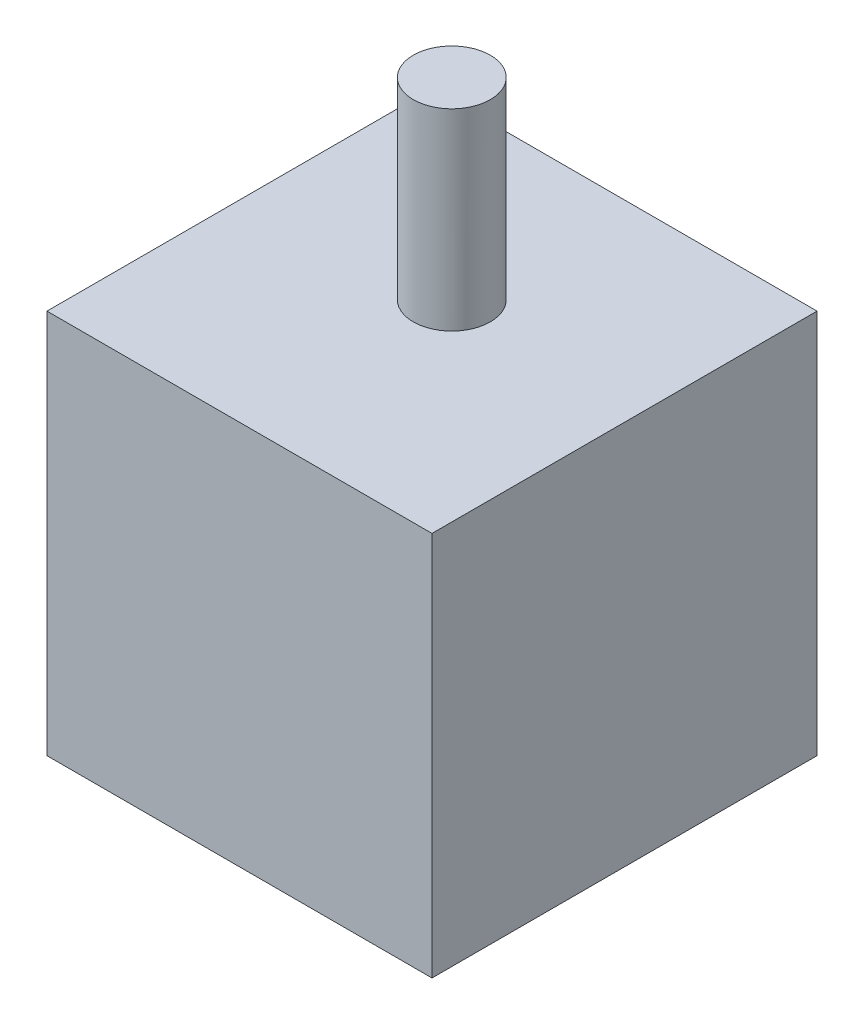
from build123d import *

# Parameters (mm, degrees)
SKETCH1_W           = 20
SKETCH1_H           = 20
BOSS_EXTRUDE1_DEPTH = 20
SKETCH2_R           = 2
BOSS_EXTRUDE2_DEPTH = 10


with BuildPart() as part:
    # Sketch1 → Boss-Extrude1 (new body)
    with BuildSketch(Plane.XY):
        with Locations((-3.515056128, -3.765337521)):
            Rectangle(SKETCH1_W, SKETCH1_H)
    extrude(amount=BOSS_EXTRUDE1_DEPTH)

    # Sketch2 → Boss-Extrude2 (add)
    with BuildSketch(Plane(origin=(0, 6.234662479, 0), x_dir=(1, 0, 0), z_dir=(0, 1, 0))):
        with Locations(Location((-3.515056128, -8.971897528, 0), (0, 0, 90))):
            Circle(SKETCH2_R)
    extrude(amount=BOSS_EXTRUDE2_DEPTH)


solid = part.part
